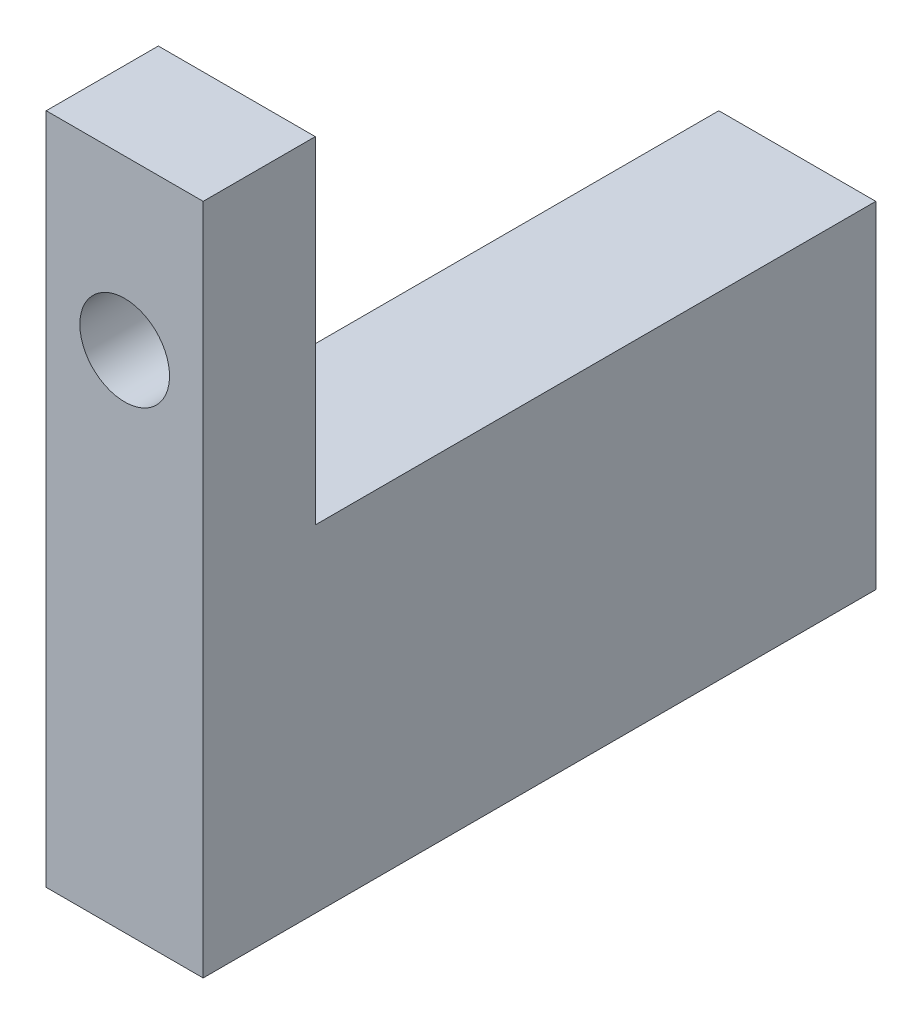
from build123d import *

# Parameters (mm, degrees)
BOSS_EXTRUDE1_DEPTH = 7
SKETCH2_R           = 2
CUT_EXTRUDE1_DEPTH  = 7


with BuildPart() as part:
    # Sketch1 → Boss-Extrude1 (new body)
    with BuildSketch(Plane(origin=(0, 0, 0), x_dir=(0, 0, -1), z_dir=(1, 0, 0))):
        Polygon((0, 0), (30, 0), (30, 15), (5, 15), (5, 30), (0, 30), align=None)
    extrude(amount=BOSS_EXTRUDE1_DEPTH)

    # Sketch2 → Cut-Extrude1 (cut)
    with BuildSketch(Plane(origin=(0, 0, -5), x_dir=(-1, 0, 0), z_dir=(0, 0, -1))):
        with Locations((-3.5, 22.5)):
            Circle(SKETCH2_R)
    extrude(amount=-CUT_EXTRUDE1_DEPTH, mode=Mode.SUBTRACT)


solid = part.part
